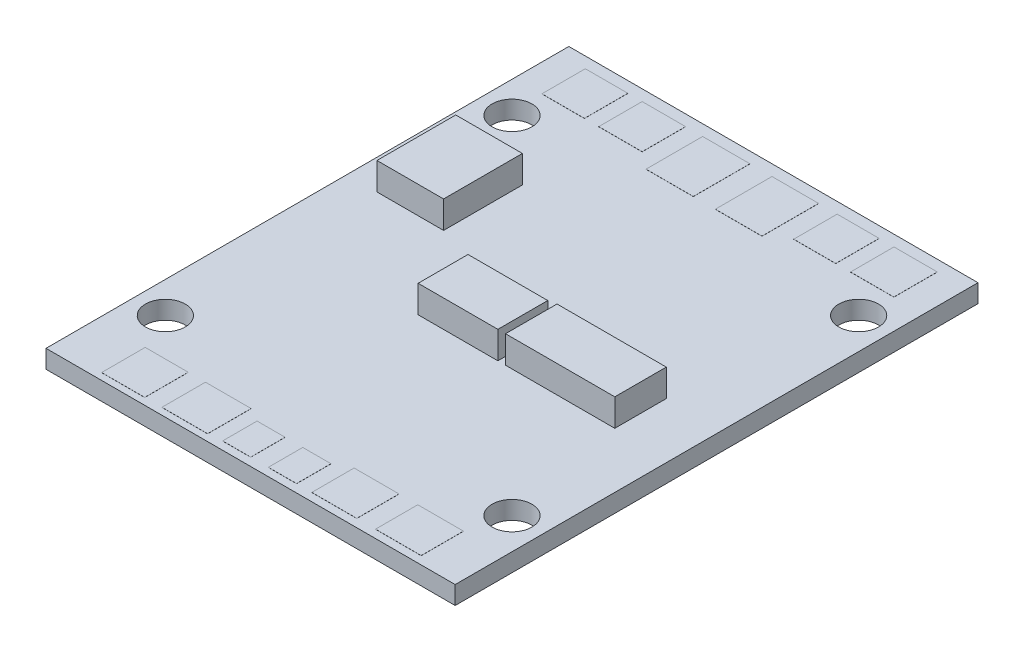
from build123d import *

# Parameters (mm, degrees)
SKETCH1_W        = 36
SKETCH1_H        = 5
SKETCH1_H_2      = 36
SKETCH1_R        = 1.75
PCB_DEPTH        = 1.6
SKETCH4_W        = 3.740798036
SKETCH4_H        = 3.820815106
SKETCH4_W_2      = 3.820815106
SKETCH4_W_3      = 4.160887655
SKETCH4_H_2      = 4.981062625
SKETCH4_W_4      = 4.100874852
SKETCH4_W_5      = 3.695656728
SKETCH4_W_6      = 3.812361676
SKETCH4_W_7      = 3.787546171
SKETCH4_H_3      = 3.830762868
SKETCH4_W_8      = 4.01762935
SKETCH4_W_9      = 2.467816827
SKETCH4_H_4      = 3.027236998
SKETCH4_W_10     = 2.483275044
SKETCH4_W_11     = 3.953731944
SKETCH4_H_5      = 3.718642979
SKETCH4_W_12     = 4.022264052
PADS_DEPTH       = 0.01
SKETCH2_W        = 5.863870515
SKETCH2_H        = 6.933382723
SKETCH2_W_2      = 7.016073618
SKETCH2_H_2      = 4.389541424
SKETCH2_W_3      = 9.613875512
SKETCH2_H_3      = 4.530712508
COMPONENTS_DEPTH = 2.4


with BuildPart() as part:
    # Sketch1 → PCB (new body)
    # profile 1 of 3: a face of its own
    with BuildSketch(Plane(origin=(0, 0, 0), x_dir=(1, 0, 0), z_dir=(0, 1, 0))):
        with Locations((0, 20.5)):
            Rectangle(SKETCH1_W, SKETCH1_H)
    # profile 2 of 3: a face of its own
    with BuildSketch(Plane(origin=(0, 0, 0), x_dir=(1, 0, 0), z_dir=(0, 1, 0))):
        Rectangle(SKETCH1_W, SKETCH1_H_2)
        with Locations(Location((-15.25, -15.25, 0), (0, 0, 270))):
            Circle(SKETCH1_R, mode=Mode.SUBTRACT)
        with Locations(Location((15.25, -15.25, 0), (0, 0, 270))):
            Circle(SKETCH1_R, mode=Mode.SUBTRACT)
        with Locations(Location((-15.25, 15.25, 0), (0, 0, 270))):
            Circle(SKETCH1_R, mode=Mode.SUBTRACT)
        with Locations(Location((15.25, 15.25, 0), (0, 0, 270))):
            Circle(SKETCH1_R, mode=Mode.SUBTRACT)
    # profile 3 of 3: a face of its own
    with BuildSketch(Plane(origin=(0, 0, 0), x_dir=(1, 0, 0), z_dir=(0, 1, 0))):
        with Locations((0, -20.5)):
            Rectangle(SKETCH1_W, SKETCH1_H)
    extrude(amount=PCB_DEPTH)

    # Sketch4 → Pads (add)
    with BuildSketch(Plane(origin=(0, 1.6, 0), x_dir=(1, 0, 0), z_dir=(0, 1, 0))):
        with Locations((-13.696501098, 20.107722338)):
            Rectangle(SKETCH4_W, SKETCH4_H)
        with Locations((-8.65542567, 20.107722338)):
            Rectangle(SKETCH4_W_2, SKETCH4_H)
        with Locations((-3.164254223, 19.527598579)):
            Rectangle(SKETCH4_W_3, SKETCH4_H_2)
        with Locations((2.907040985, 19.527598579)):
            Rectangle(SKETCH4_W_4, SKETCH4_H_2)
        with Locations((8.437153549, 20.107722338)):
            Rectangle(SKETCH4_W_5, SKETCH4_H)
        with Locations((13.494368018, 20.107722338)):
            Rectangle(SKETCH4_W_6, SKETCH4_H)
        with Locations((-11.802728013, -20.491019937)):
            Rectangle(SKETCH4_W_7, SKETCH4_H_3)
        with Locations((-6.386521753, -20.491019937)):
            Rectangle(SKETCH4_W_8, SKETCH4_H_3)
        with Locations((-1.930345809, -20.780662983)):
            Rectangle(SKETCH4_W_9, SKETCH4_H_4)
        with Locations((2.098241081, -20.780662983)):
            Rectangle(SKETCH4_W_10, SKETCH4_H_4)
        with Locations((6.660299296, -20.434959993)):
            Rectangle(SKETCH4_W_11, SKETCH4_H_5)
        with Locations((12.296113939, -20.434959993)):
            Rectangle(SKETCH4_W_12, SKETCH4_H_5)
    extrude(amount=PADS_DEPTH)

    # Sketch2 → Components (add)
    with BuildSketch(Plane(origin=(0, 1.6, 0), x_dir=(1, 0, 0), z_dir=(0, 1, 0))):
        with Locations((-12.422852881, 6.938659117)):
            Rectangle(SKETCH2_W, SKETCH2_H)
        with Locations((-0.676707896, -1.879325534)):
            Rectangle(SKETCH2_W_2, SKETCH2_H_2)
        with Locations((8.311019041, -1.808739992)):
            Rectangle(SKETCH2_W_3, SKETCH2_H_3)
    extrude(amount=COMPONENTS_DEPTH)


solid = part.part
